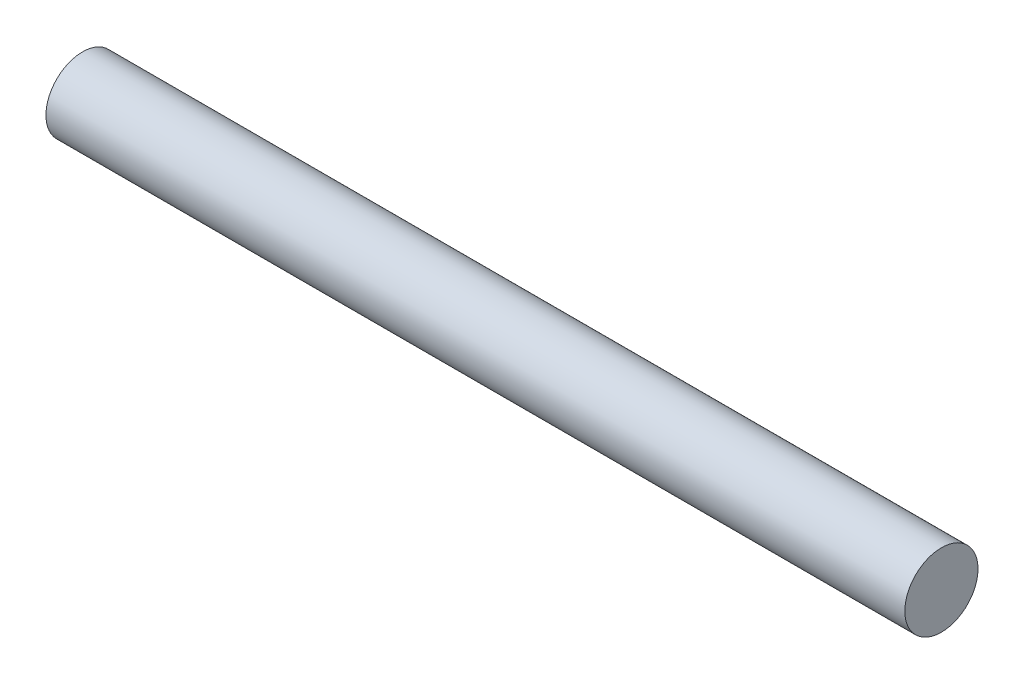
from build123d import *

# Parameters (mm, degrees)
SKETCH1_R           = 2.5
BOSS_EXTRUDE1_DEPTH = 58.674


with BuildPart() as part:
    # Sketch1 → Boss-Extrude1 (new body)
    with BuildSketch(Plane(origin=(0, 0, 0), x_dir=(0, 0, -1), z_dir=(1, 0, 0))):
        Circle(SKETCH1_R)
    extrude(amount=BOSS_EXTRUDE1_DEPTH)


solid = part.part
